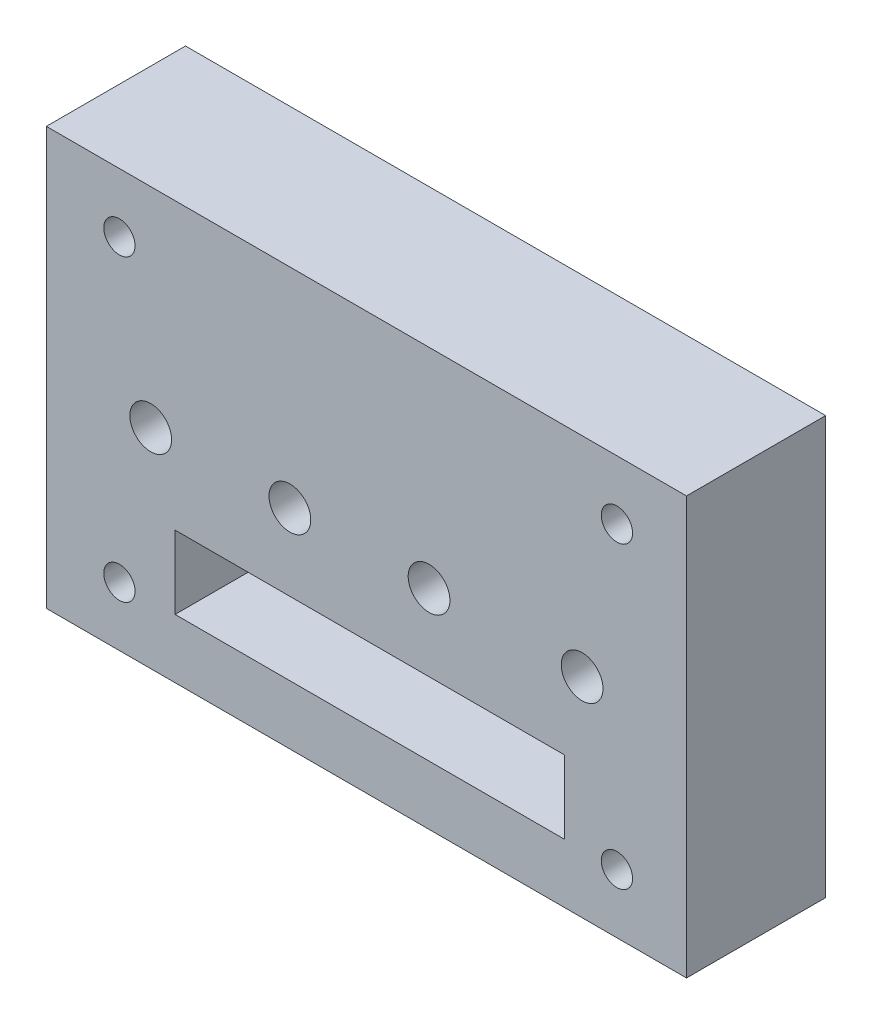
from build123d import *

# Parameters (mm, degrees)
SKETCH3_W           = 92
SKETCH3_H           = 60
SKETCH3_W_2         = 76.5
SKETCH3_H_2         = 48
SKETCH3_R           = 2.25
SKETCH3_R_2         = 3
SKETCH3_W_3         = 56
SKETCH3_H_3         = 10.5
BOSS_EXTRUDE3_DEPTH = 20


with BuildPart() as part:
    # Sketch3 → Boss-Extrude3 (new body)
    # profile 1 of 2: a face of its own
    with BuildSketch(Plane.XY):
        with Locations((46, 30)):
            Rectangle(SKETCH3_W, SKETCH3_H)
        with Locations((46.25, 30)):
            Rectangle(SKETCH3_W_2, SKETCH3_H_2, mode=Mode.SUBTRACT)
    # profile 2 of 2: a face of its own
    with BuildSketch(Plane.XY):
        with Locations((46.25, 30)):
            Rectangle(SKETCH3_W_2, SKETCH3_H_2)
        with Locations((10.5, 51.5)):
            Circle(SKETCH3_R, mode=Mode.SUBTRACT)
        with Locations((10.5, 8.5)):
            Circle(SKETCH3_R, mode=Mode.SUBTRACT)
        with Locations((82, 8.5)):
            Circle(SKETCH3_R, mode=Mode.SUBTRACT)
        with Locations((82, 51.5)):
            Circle(SKETCH3_R, mode=Mode.SUBTRACT)
        with Locations((77, 30)):
            Circle(SKETCH3_R_2, mode=Mode.SUBTRACT)
        with Locations((55, 30)):
            Circle(SKETCH3_R_2, mode=Mode.SUBTRACT)
        with Locations((35, 30)):
            Circle(SKETCH3_R_2, mode=Mode.SUBTRACT)
        with Locations((15, 30)):
            Circle(SKETCH3_R_2, mode=Mode.SUBTRACT)
        with Locations((46.5, 13.75)):
            Rectangle(SKETCH3_W_3, SKETCH3_H_3, mode=Mode.SUBTRACT)
    extrude(amount=BOSS_EXTRUDE3_DEPTH)


solid = part.part
